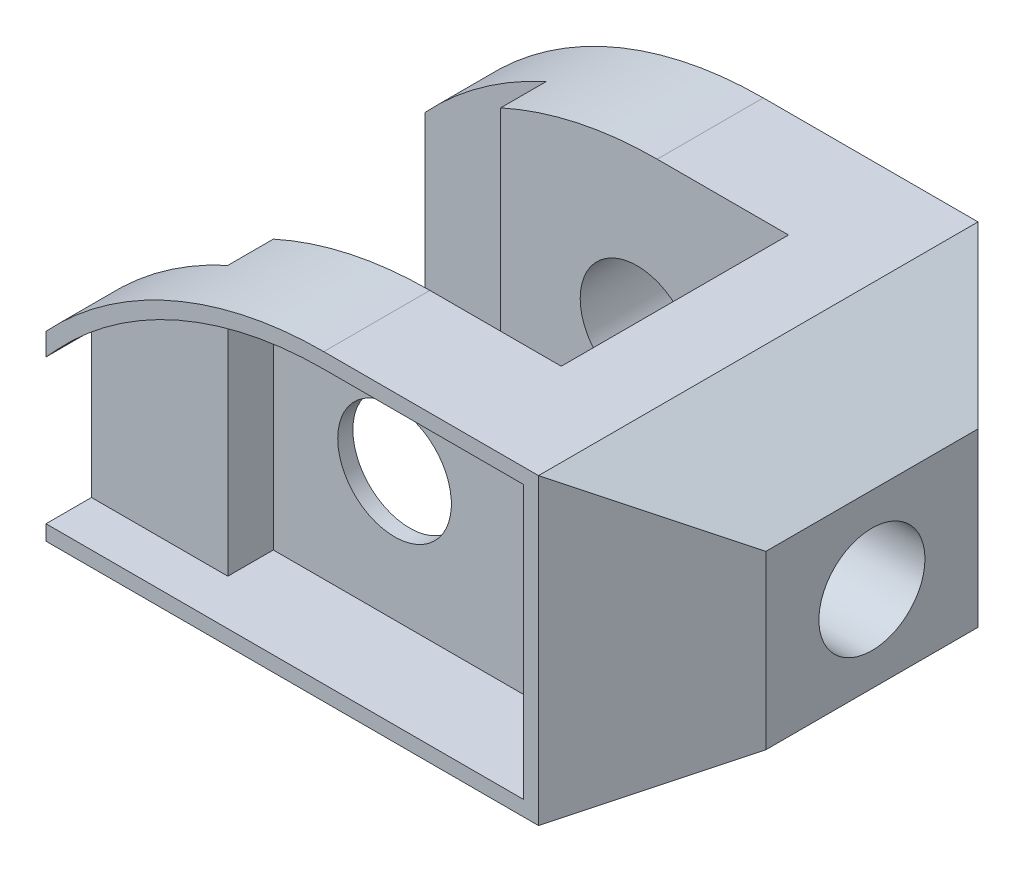
from build123d import *

# Parameters (mm, degrees)
SKETCH1_R           = 7.5
BOSS_EXTRUDE1_DEPTH = 29
CUT_EXTRUDE1_DEPTH  = 58
CUT_EXTRUDE2_DEPTH  = 58
SKETCH7_R           = 7
CUT_EXTRUDE3_DEPTH  = 58
CUT_EXTRUDE4_DEPTH  = 6
CUT_EXTRUDE5_DEPTH  = 6


with BuildPart() as part:
    # Sketch1 → Boss-Extrude1 (new, symmetric)
    with BuildSketch(Plane.XY):
        with BuildLine():
            Line((0, 0), (65, 0))
            Line((65, 0), (80, 8.660254038))
            Line((80, 8.660254038), (80, 31.339745962))
            Line((80, 31.339745962), (65, 40))
            Line((65, 40), (36.66060556, 40))
            ThreePointArc((36.66060556, 40), (16.66060556, 35.82575695), (0, 24))
            Line((0, 24), (0, 0))
        make_face()
        with Locations(Location((34, 19, 0), (0, 0, 180))):
            Circle(SKETCH1_R, mode=Mode.SUBTRACT)
    extrude(amount=BOSS_EXTRUDE1_DEPTH, both=True)

    # Sketch2 → Cut-Extrude1 (cut)
    with BuildSketch(Plane(origin=(0, 0, 0), x_dir=(1, 0, 0), z_dir=(0, 1, 0))):
        Polygon((0, 21), (16, 21), (16, 15), (54, 15), (54, -15), (16, -15), (16, -21), (0, -21), align=None)
    extrude(amount=CUT_EXTRUDE1_DEPTH, mode=Mode.SUBTRACT)

    # Sketch3 → Cut-Extrude2 (cut)
    with BuildSketch(Plane(origin=(0, 0, 0), x_dir=(1, 0, 0), z_dir=(0, 1, 0))):
        Polygon((80, 29), (65, 29), (80, 14), align=None)
        Polygon((80, -29), (65, -29), (80, -14), align=None)
    extrude(amount=CUT_EXTRUDE2_DEPTH, mode=Mode.SUBTRACT)

    # Sketch7 → Cut-Extrude3 (cut)
    with BuildSketch(Plane(origin=(80, 0, 0), x_dir=(0, 0, -1), z_dir=(1, 0, 0))):
        with Locations((0, 20)):
            Circle(SKETCH7_R)
    extrude(amount=-CUT_EXTRUDE3_DEPTH, mode=Mode.SUBTRACT)

    # Sketch8 → Cut-Extrude4 (cut)
    with BuildSketch(Plane.XY.offset(29)):
        with BuildLine():
            Line((0, 2), (63, 2))
            Line((63, 2), (63, 38))
            Line((63, 38), (36.66060556, 38))
            ThreePointArc((36.66060556, 38), (17.46060556, 33.992726672), (1.466424222, 22.64))
            Line((1.466424222, 22.64), (0, 21.058823529))
            Line((0, 21.058823529), (0, 2))
        make_face()
    extrude(amount=-CUT_EXTRUDE4_DEPTH, mode=Mode.SUBTRACT)

    # Sketch9 → Cut-Extrude5 (cut)
    with BuildSketch(Plane.XY.offset(23)):
        with BuildLine():
            Line((18, 34.224221872), (18, 2))
            Line((18, 2), (63, 2))
            Line((63, 2), (63, 38))
            Line((63, 38), (36.66060556, 38))
            ThreePointArc((36.66060556, 38), (27.141221384, 37.046586751), (18, 34.224221872))
        make_face()
    extrude(amount=-CUT_EXTRUDE5_DEPTH, mode=Mode.SUBTRACT)


solid = part.part
